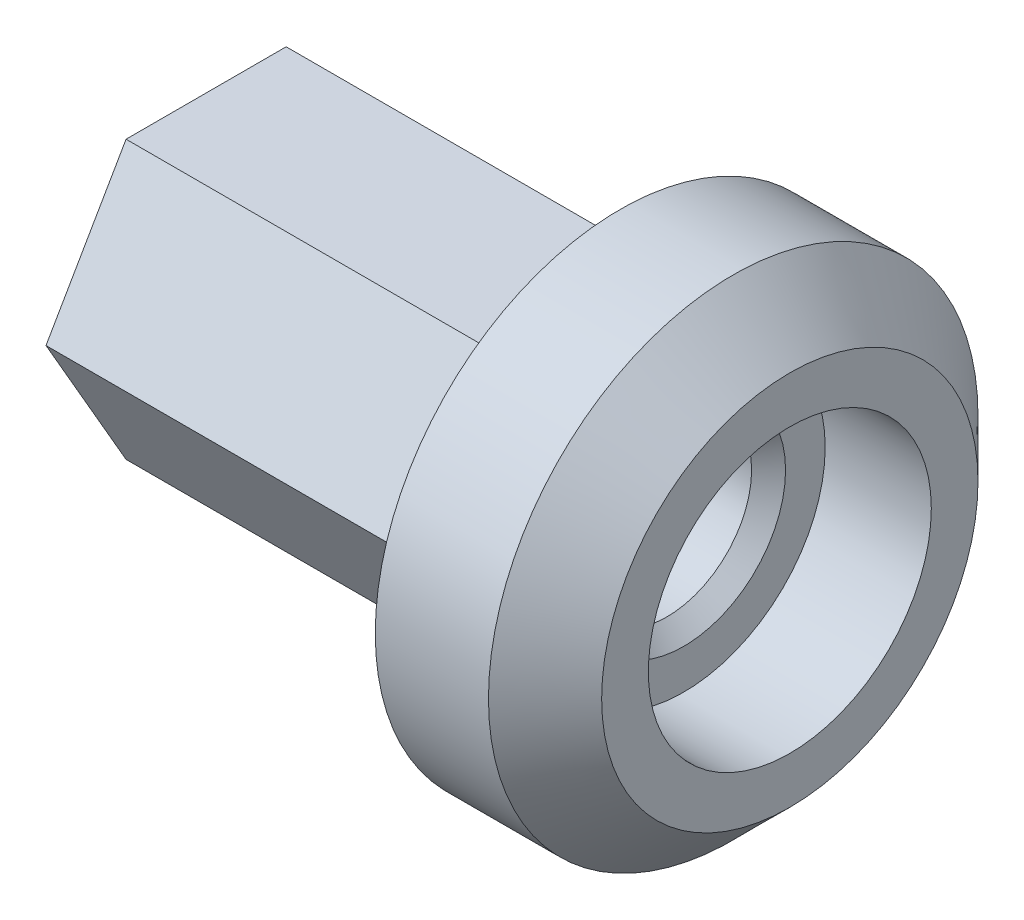
from build123d import *

# Parameters (mm, degrees)
SKETCH1_R           = 3.81
BOSS_EXTRUDE1_DEPTH = 18.5775
BOSS_EXTRUDE2_START = 7.62
SKETCH2_R           = 10.9855
SKETCH2_R_2         = 3.81
BOSS_EXTRUDE2_DEPTH = 7.62
SKETCH3_R           = 6.35
CUT_EXTRUDE1_DEPTH  = 4.7625
CHAMFER1_SIZE       = 2.54
CHAMFER2_SIZE       = 0.762


with BuildPart() as part:
    # Sketch1 → Boss-Extrude1 (new body)
    with BuildSketch(Plane(origin=(0, 0, 0), x_dir=(0, 0, -1), z_dir=(1, 0, 0))):
        Polygon((3.592850725, 6.223), (-3.592850725, 6.223), (-7.18570145, 0), (-3.592850725, -6.223), (3.592850725, -6.223), (7.18570145, 0), align=None)
        Circle(SKETCH1_R, mode=Mode.SUBTRACT)
    extrude(amount=-BOSS_EXTRUDE1_DEPTH)

    # Sketch2 → Boss-Extrude2 (add)
    with BuildSketch(Plane(origin=(0, 0, 0), x_dir=(0, 0, -1), z_dir=(1, 0, 0)).offset(BOSS_EXTRUDE2_START)):
        with Locations(Location((0, 0, 0), (0, 0, 180))):
            Circle(SKETCH2_R)
        Circle(SKETCH2_R_2, mode=Mode.SUBTRACT)
    extrude(amount=-BOSS_EXTRUDE2_DEPTH)

    # Sketch3 → Cut-Extrude1 (cut)
    with BuildSketch(Plane(origin=(7.62, 0, 0), x_dir=(0, 0, -1), z_dir=(1, 0, 0))):
        Circle(SKETCH3_R)
    extrude(amount=-CUT_EXTRUDE1_DEPTH, mode=Mode.SUBTRACT)

    # Chamfer1
    chamfer1_edges = [part.edges().sort_by_distance(p)[0] for p in [
        (7.62, 0, -10.9855),
    ]]
    chamfer(chamfer1_edges, length=CHAMFER1_SIZE)

    # Chamfer2
    chamfer2_edges = [part.edges().sort_by_distance(p)[0] for p in [
        (2.8575, 0, 3.81),
        (-18.5775, 0, 3.81),
    ]]
    chamfer(chamfer2_edges, length=CHAMFER2_SIZE)


solid = part.part
